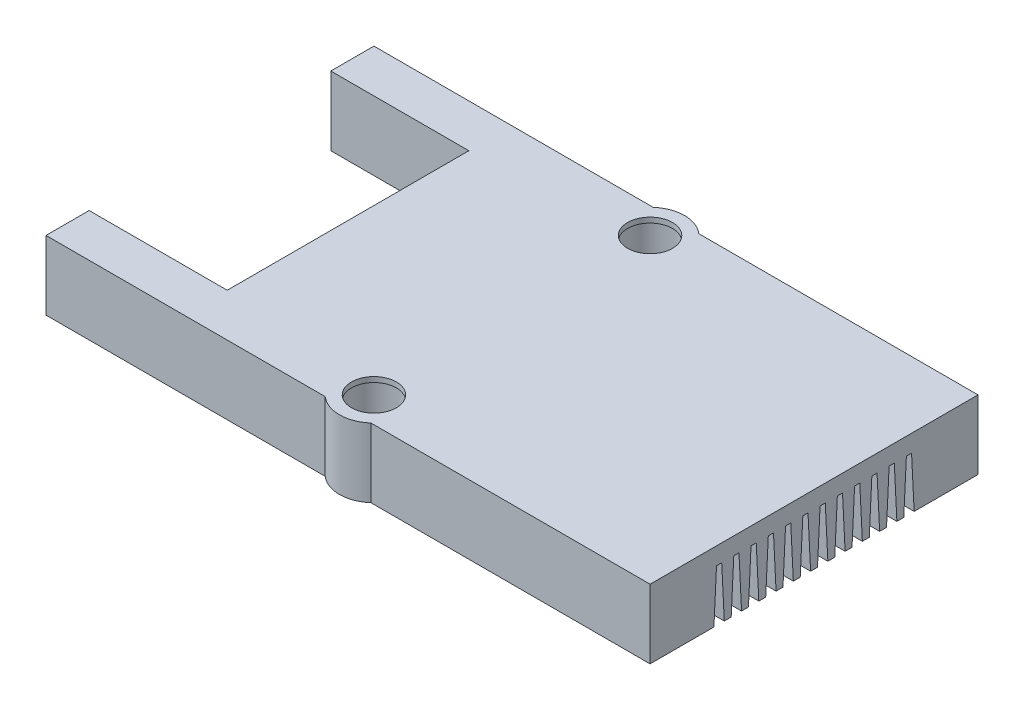
from build123d import *

# Parameters (mm, degrees)
SKETCH1_R           = 15
BOSS_EXTRUDE2_DEPTH = 40
SKETCH1_4_R         = 15
SKETCH1_4_R_2       = 13
BOSS_EXTRUDE3_DEPTH = 3
CUT_EXTRUDE1_DEPTH  = 291.688837075


with BuildPart() as part:
    # Sketch1 → Boss-Extrude2 (new body)
    with BuildSketch(Plane(origin=(0, 0, 0), x_dir=(1, 0, 0), z_dir=(0, 1, 0))):
        with BuildLine():
            Line((-13.228756555, 95), (-175, 95))
            Line((-175, 95), (-175, 70))
            Line((-175, 70), (-95, 70))
            Line((-95, 70), (-95, -70))
            Line((-95, -70), (-175, -70))
            Line((-175, -70), (-175, -95))
            Line((-175, -95), (-13.228756555, -95))
            ThreePointArc((-13.228756555, -95), (0, -100), (13.228756555, -95))
            Line((13.228756555, -95), (175, -95))
            Line((175, -95), (175, 95))
            Line((175, 95), (13.228756555, 95))
            ThreePointArc((13.228756555, 95), (0, 100), (-13.228756555, 95))
        make_face()
        with Locations((0, -80)):
            Circle(SKETCH1_R, mode=Mode.SUBTRACT)
        with Locations((0, 80)):
            Circle(SKETCH1_R, mode=Mode.SUBTRACT)
    extrude(amount=-BOSS_EXTRUDE2_DEPTH)

    # Sketch1<4> → Boss-Extrude3 (add)
    # profile 1 of 2: a face of its own
    with BuildSketch(Plane(origin=(0, 0, 0), x_dir=(1, 0, 0), z_dir=(0, 1, 0))):
        with Locations((0, 80)):
            Circle(SKETCH1_4_R)
        with Locations((0, 80)):
            Circle(SKETCH1_4_R_2, mode=Mode.SUBTRACT)
    # profile 2 of 2: a face of its own
    with BuildSketch(Plane(origin=(0, 0, 0), x_dir=(1, 0, 0), z_dir=(0, 1, 0))):
        with Locations((0, -80)):
            Circle(SKETCH1_4_R)
        with Locations((0, -80)):
            Circle(SKETCH1_4_R_2, mode=Mode.SUBTRACT)
    extrude(amount=-BOSS_EXTRUDE3_DEPTH)

    # Sketch3 → Cut-Extrude1 (cut, through all)
    with BuildSketch(Plane.ZY.offset(95)):
        Polygon((-58, -40), (-56.5, -10), (-53.5, -10), (-52, -40), align=None)
        Polygon((-48, -40), (-46.5, -10), (-43.5, -10), (-42, -40), align=None)
        Polygon((-38, -40), (-36.5, -10), (-33.5, -10), (-32, -40), align=None)
        Polygon((-28, -40), (-26.5, -10), (-23.5, -10), (-22, -40), align=None)
        Polygon((-18, -40), (-16.5, -10), (-13.5, -10), (-12, -40), align=None)
        Polygon((-8, -40), (-6.5, -10), (-3.5, -10), (-2, -40), align=None)
        Polygon((2, -40), (3.5, -10), (6.5, -10), (8, -40), align=None)
        Polygon((12, -40), (13.5, -10), (16.5, -10), (18, -40), align=None)
        Polygon((22, -40), (23.5, -10), (26.5, -10), (28, -40), align=None)
        Polygon((32, -40), (33.5, -10), (36.5, -10), (38, -40), align=None)
        Polygon((42, -40), (43.5, -10), (46.5, -10), (48, -40), align=None)
        Polygon((52, -40), (53.5, -10), (56.5, -10), (58, -40), align=None)
    extrude(amount=-CUT_EXTRUDE1_DEPTH, mode=Mode.SUBTRACT)


solid = part.part
